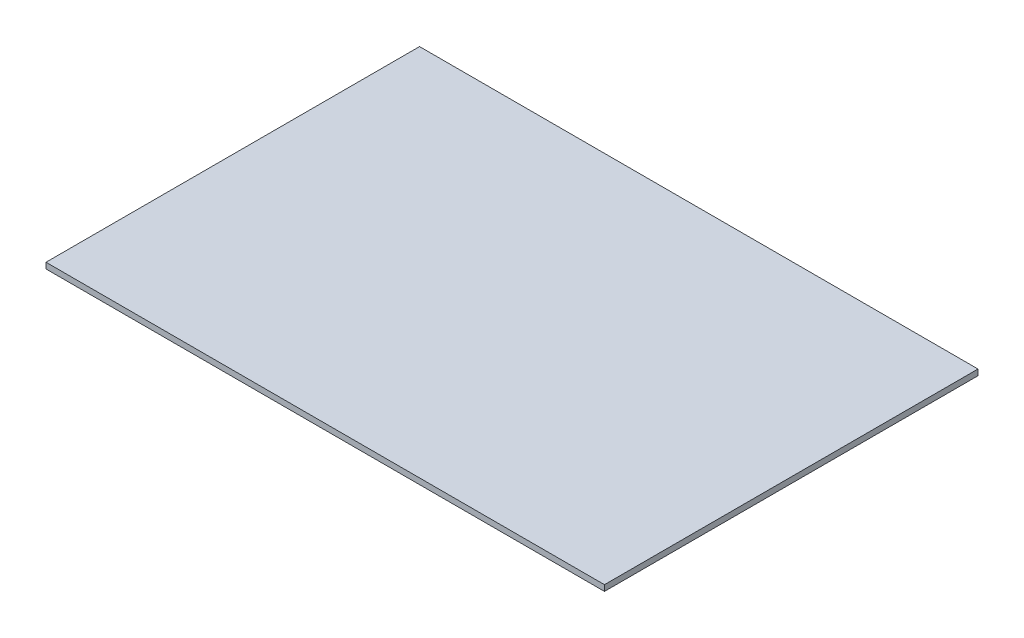
from build123d import *

# Parameters (mm, degrees)
SKETCH5_W           = 152.5
SKETCH5_H           = 102
BOSS_EXTRUDE1_DEPTH = 1.6


with BuildPart() as part:
    # Sketch5 → Boss-Extrude1 (new body)
    with BuildSketch(Plane(origin=(0, 0, 0), x_dir=(1, 0, 0), z_dir=(0, 1, 0))):
        Rectangle(SKETCH5_W, SKETCH5_H)
    extrude(amount=BOSS_EXTRUDE1_DEPTH)


solid = part.part
